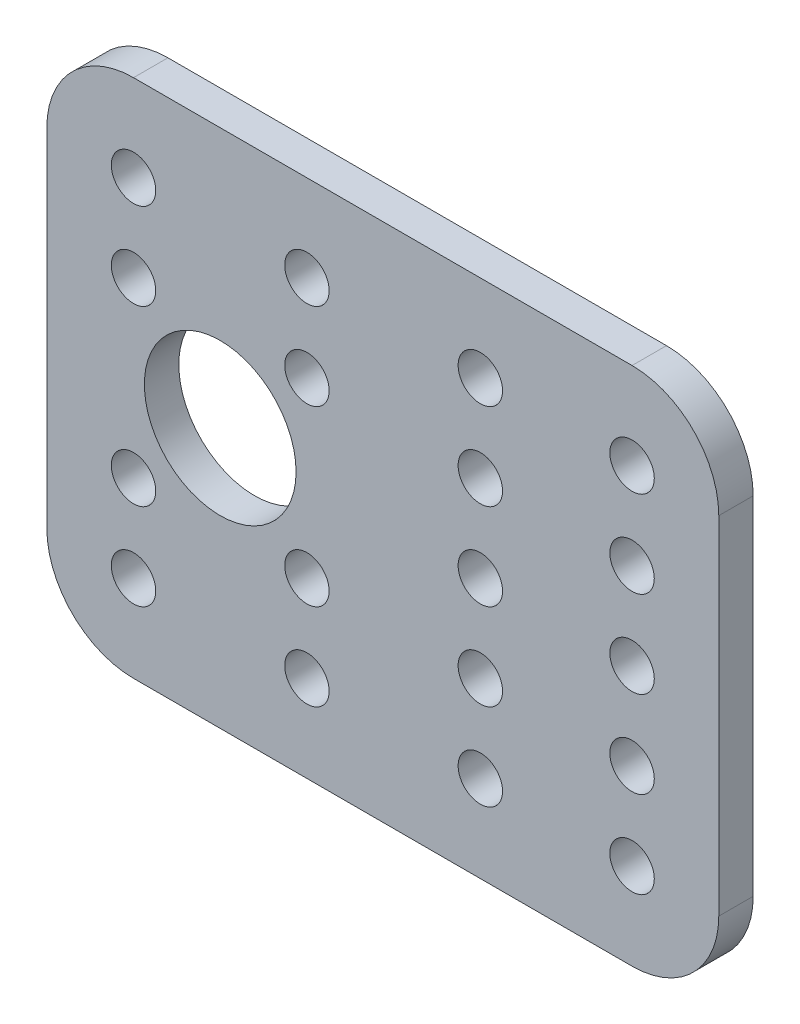
from build123d import *

# Parameters (mm, degrees)
SKETCH1_W           = 62
SKETCH1_H           = 48
SKETCH1_R           = 7
SKETCH1_R_2         = 2.05
BOSS_EXTRUDE1_DEPTH = 3.175
FILLET1_R           = 8


with BuildPart() as part:
    # Sketch1 → Boss-Extrude1 (new body)
    with BuildSketch(Plane.XY):
        Rectangle(SKETCH1_W, SKETCH1_H)
        with Locations((-15, 0)):
            Circle(SKETCH1_R, mode=Mode.SUBTRACT)
        with Locations((-23, 16)):
            Circle(SKETCH1_R_2, mode=Mode.SUBTRACT)
        with Locations((-7, 16)):
            Circle(SKETCH1_R_2, mode=Mode.SUBTRACT)
        with Locations((9, 16)):
            Circle(SKETCH1_R_2, mode=Mode.SUBTRACT)
        with Locations((-7, 8)):
            Circle(SKETCH1_R_2, mode=Mode.SUBTRACT)
        with Locations((9, 8)):
            Circle(SKETCH1_R_2, mode=Mode.SUBTRACT)
        with Locations((9, 0)):
            Circle(SKETCH1_R_2, mode=Mode.SUBTRACT)
        with Locations((-7, -8)):
            Circle(SKETCH1_R_2, mode=Mode.SUBTRACT)
        with Locations((9, -8)):
            Circle(SKETCH1_R_2, mode=Mode.SUBTRACT)
        with Locations((-7, -16)):
            Circle(SKETCH1_R_2, mode=Mode.SUBTRACT)
        with Locations((9, -16)):
            Circle(SKETCH1_R_2, mode=Mode.SUBTRACT)
        with Locations((-23, 8)):
            Circle(SKETCH1_R_2, mode=Mode.SUBTRACT)
        with Locations((-23, -8)):
            Circle(SKETCH1_R_2, mode=Mode.SUBTRACT)
        with Locations((-23, -16)):
            Circle(SKETCH1_R_2, mode=Mode.SUBTRACT)
        with Locations((23, 16)):
            Circle(SKETCH1_R_2, mode=Mode.SUBTRACT)
        with Locations((23, 8)):
            Circle(SKETCH1_R_2, mode=Mode.SUBTRACT)
        with Locations((23, 0)):
            Circle(SKETCH1_R_2, mode=Mode.SUBTRACT)
        with Locations((23, -8)):
            Circle(SKETCH1_R_2, mode=Mode.SUBTRACT)
        with Locations((23, -16)):
            Circle(SKETCH1_R_2, mode=Mode.SUBTRACT)
    extrude(amount=BOSS_EXTRUDE1_DEPTH)

    # Fillet1
    fillet1_edges = [part.edges().sort_by_distance(p)[0] for p in [
        (-31, 24, 1.5875),
        (31, 24, 1.5875),
        (31, -24, 1.5875),
        (-31, -24, 1.5875),
    ]]
    fillet(fillet1_edges, radius=FILLET1_R)


solid = part.part
